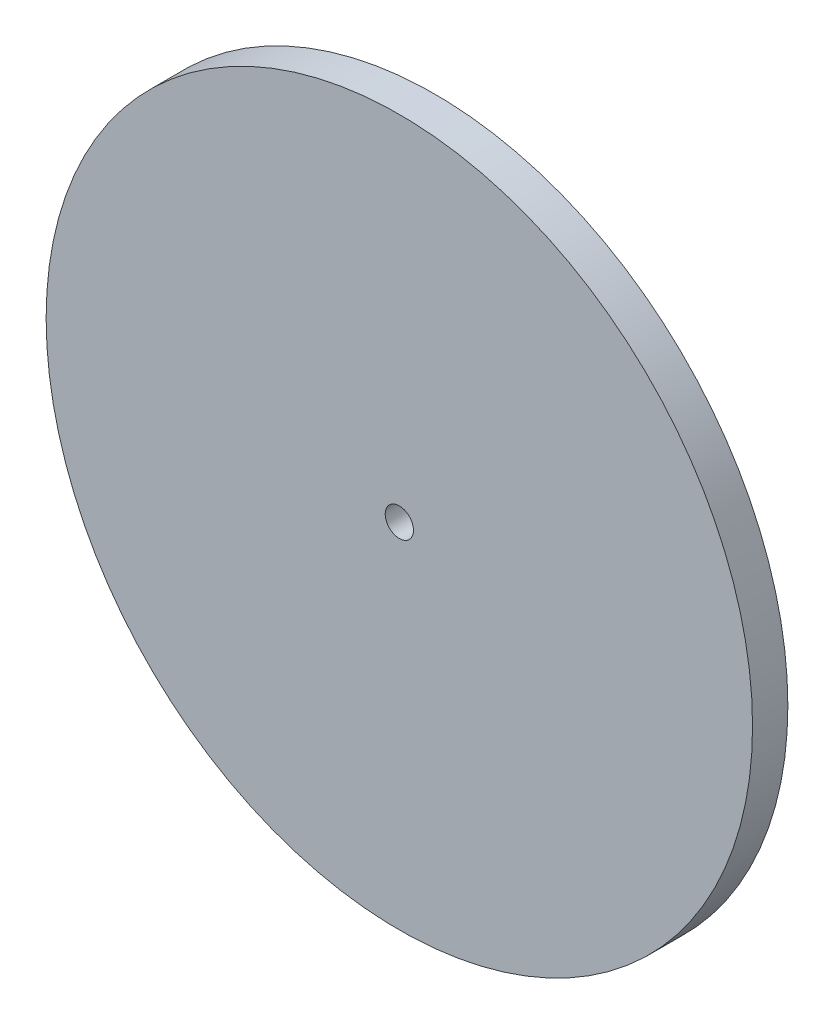
from build123d import *

# Parameters (mm, degrees)
SKETCH1_R           = 100
SKETCH1_R_2         = 4
BOSS_EXTRUDE1_DEPTH = 10


with BuildPart() as part:
    # Sketch1 → Boss-Extrude1 (new body)
    with BuildSketch(Plane.XY):
        Circle(SKETCH1_R)
        Circle(SKETCH1_R_2, mode=Mode.SUBTRACT)
    extrude(amount=BOSS_EXTRUDE1_DEPTH)


solid = part.part
